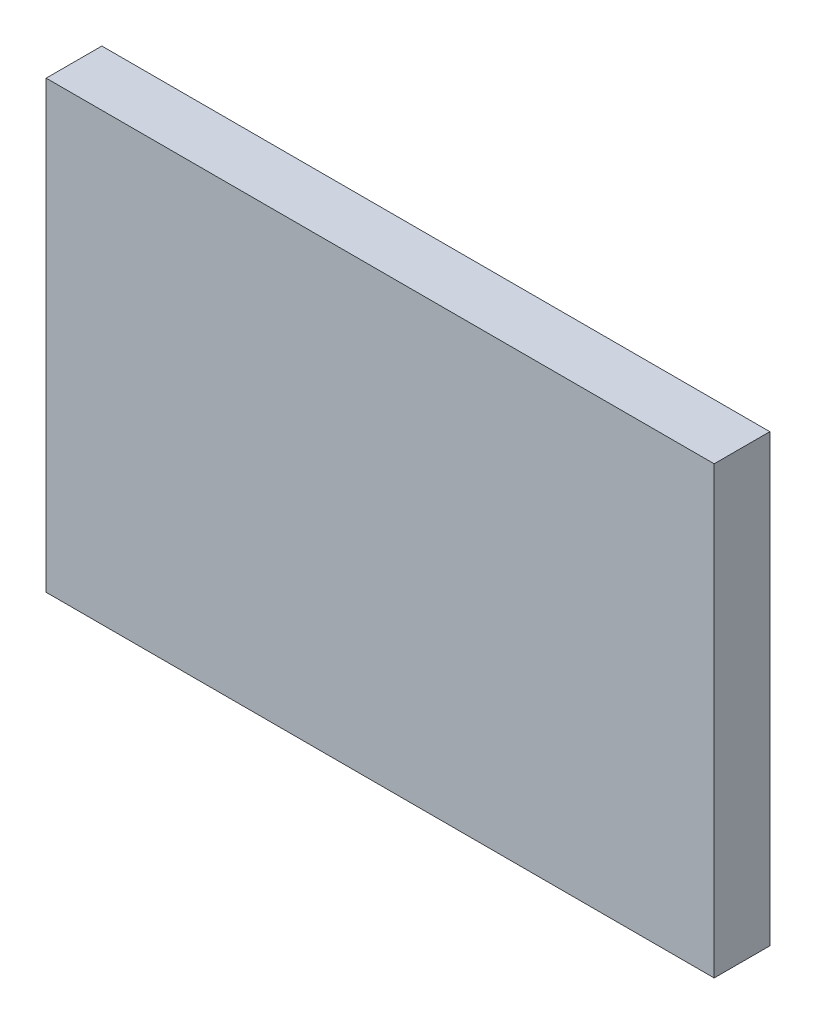
from build123d import *

# Parameters (mm, degrees)
SKETCH1_W           = 152.4
SKETCH1_H           = 101.6
BOSS_EXTRUDE1_DEPTH = 6.35


with BuildPart() as part:
    # Sketch1 → Boss-Extrude1 (new, symmetric)
    with BuildSketch(Plane.XY):
        Rectangle(SKETCH1_W, SKETCH1_H)
    extrude(amount=BOSS_EXTRUDE1_DEPTH, both=True)


solid = part.part
